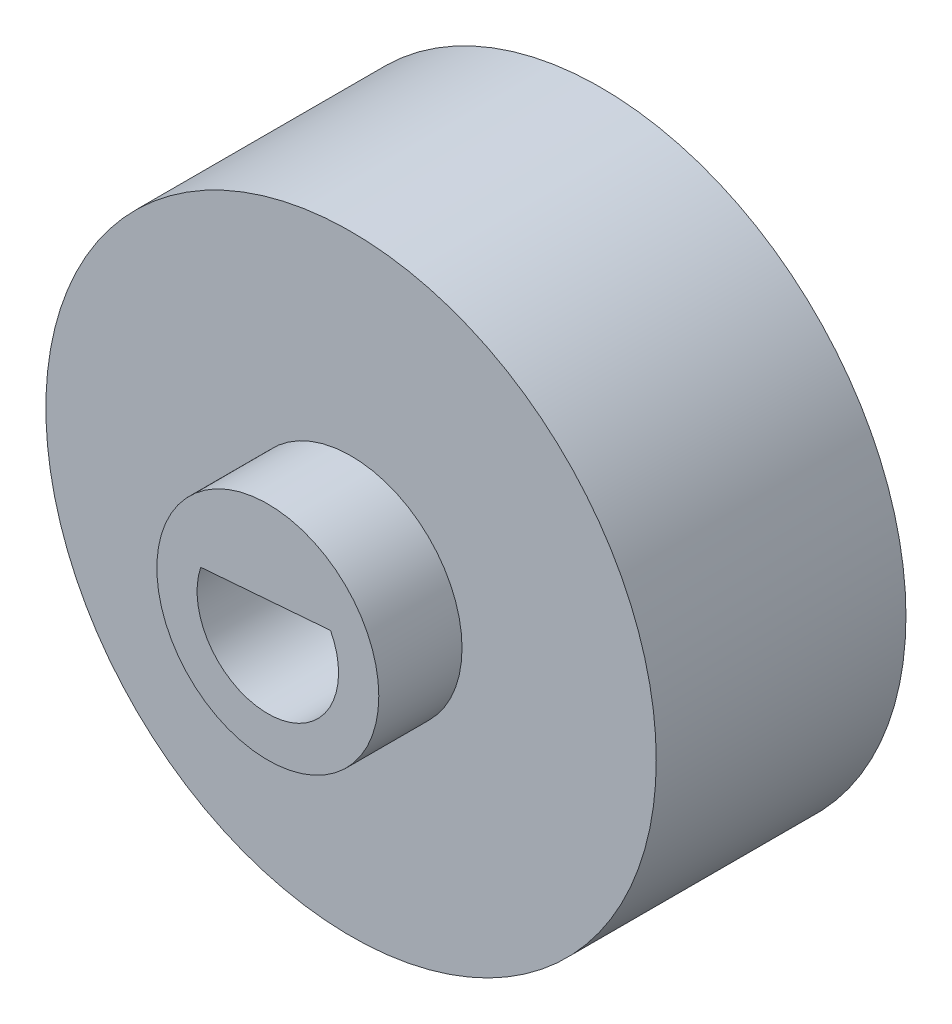
from build123d import *

# Parameters (mm, degrees)
SKETCH_1_R      = 8
EXTRUDE_1_DEPTH = 24
SKETCH_2_R      = 22
SKETCH_2_R_2    = 8
EXTRUDE_2_DEPTH = 18


with BuildPart() as part:
    # 草图1 → 凸台-拉伸1 (new body)
    with BuildSketch(Plane.XY):
        Circle(SKETCH_1_R)
        with BuildLine():
            Line((4.520101179, 2.361924075), (-4.833937562, 1.62574526))
            ThreePointArc((-4.833937562, 1.62574526), (0.400141388, -5.084278402), (4.520101179, 2.361924075))
        make_face(mode=Mode.SUBTRACT)
    extrude(amount=EXTRUDE_1_DEPTH)

    # 草图2 → 凸台-拉伸2 (add)
    with BuildSketch(Plane.XY):
        Circle(SKETCH_2_R)
        Circle(SKETCH_2_R_2, mode=Mode.SUBTRACT)
    extrude(amount=EXTRUDE_2_DEPTH)


solid = part.part
